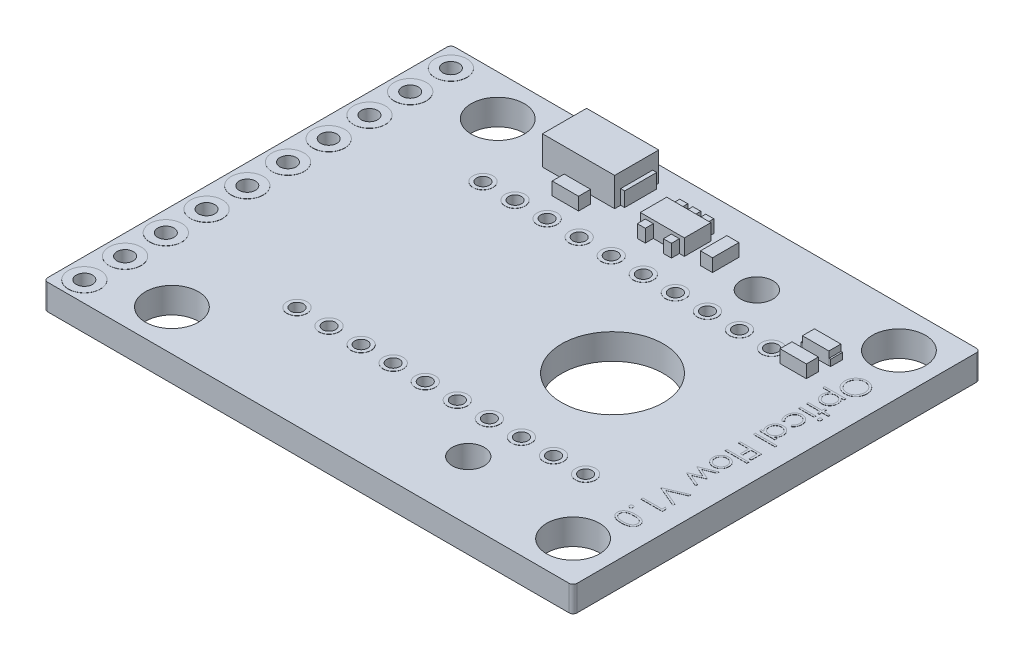
from build123d import *

# Parameters (mm, degrees)
SKETCH1_W             = 33.02
SKETCH1_H             = 25.4
SKETCH1_R             = 1.651
BOSS_EXTRUDE1_DEPTH   = 1.6
SKETCH2_R             = 3.175
SKETCH2_R_2           = 0.4
SKETCH2_R_3           = 1
CUT_EXTRUDE1_DEPTH    = 42.689811705
SKETCH3_R             = 0.508
CUT_EXTRUDE2_DEPTH    = 42.689811705
SKETCH4_W             = 4.5
SKETCH4_H             = 2.75
BOSS_EXTRUDE2_DEPTH   = 1.8
SKETCH5_W             = 0.25
SKETCH5_H             = 2
BOSS_EXTRUDE3_DEPTH   = 0.9
SKETCH6_W             = 2.75
SKETCH6_H             = 1.65
BOSS_EXTRUDE4_DEPTH   = 1
SKETCH7_W             = 0.5
SKETCH7_H             = 0.5
SKETCH7_W_2           = 0.75
SKETCH7_H_2           = 1.64678031
SKETCH7_W_3           = 1.64678031
SKETCH7_H_3           = 0.75
BOSS_EXTRUDE5_DEPTH   = 0.8
BOSS_EXTRUDE6_START   = 0.01
SKETCH9_R             = 1
SKETCH9_R_2           = 0.508
SKETCH9_R_3           = 0.625
SKETCH9_R_4           = 0.4
BOSS_EXTRUDE6_DEPTH   = 0.01
FILLET1_R             = 0.25
SKETCH10_W            = 0.966746795
SKETCH10_H            = 0.118723291
SKETCH10_W_2          = 1.356837607
BOSS_EXTRUDE7_DEPTH   = 0.01
SKETCH11_W            = 0.1
SKETCH11_H            = 0.75
BOSS_EXTRUDE8_DEPTH   = 0.4
SKETCH11_H_2          = 0.740520376
BOSS_EXTRUDE8_2_DEPTH = 0.4


with BuildPart() as part:
    # Sketch1 → Boss-Extrude1 (new body)
    with BuildSketch(Plane(origin=(0, 0, 0), x_dir=(1, 0, 0), z_dir=(0, 1, 0))):
        with Locations((16.51, 12.7)):
            Rectangle(SKETCH1_W, SKETCH1_H)
        with Locations(Location((5.461, 2.54, 0), (0, 0, 270))):
            Circle(SKETCH1_R, mode=Mode.SUBTRACT)
        with Locations(Location((30.48, 2.54, 0), (0, 0, 270))):
            Circle(SKETCH1_R, mode=Mode.SUBTRACT)
        with Locations(Location((30.48, 22.86, 0), (0, 0, 90))):
            Circle(SKETCH1_R, mode=Mode.SUBTRACT)
        with Locations(Location((5.461, 22.86, 0), (0, 0, 90))):
            Circle(SKETCH1_R, mode=Mode.SUBTRACT)
    extrude(amount=BOSS_EXTRUDE1_DEPTH)

    # Sketch2 → Cut-Extrude1 (cut, through all)
    with BuildSketch(Plane(origin=(0, 1.6, 0), x_dir=(1, 0, 0), z_dir=(0, 1, 0))):
        with Locations(Location((22.78, 12.7, 0), (0, 0, 270))):
            Circle(SKETCH2_R)
        with Locations(Location((27.4, 6.4, 0), (0, 0, 270))):
            Circle(SKETCH2_R_2)
        with Locations(Location((25.4, 6.4, 0), (0, 0, 270))):
            Circle(SKETCH2_R_2)
        with Locations(Location((23.4, 6.4, 0), (0, 0, 270))):
            Circle(SKETCH2_R_2)
        with Locations(Location((21.4, 6.4, 0), (0, 0, 270))):
            Circle(SKETCH2_R_2)
        with Locations(Location((19.4, 6.4, 0), (0, 0, 270))):
            Circle(SKETCH2_R_2)
        with Locations(Location((17.4, 6.4, 0), (0, 0, 270))):
            Circle(SKETCH2_R_2)
        with Locations(Location((15.4, 6.4, 0), (0, 0, 270))):
            Circle(SKETCH2_R_2)
        with Locations(Location((13.4, 6.4, 0), (0, 0, 270))):
            Circle(SKETCH2_R_2)
        with Locations(Location((11.4, 6.4, 0), (0, 0, 270))):
            Circle(SKETCH2_R_2)
        with Locations(Location((9.4, 6.4, 0), (0, 0, 270))):
            Circle(SKETCH2_R_2)
        with Locations(Location((26.4, 19, 0), (0, 0, 270))):
            Circle(SKETCH2_R_2)
        with Locations(Location((24.4, 19, 0), (0, 0, 270))):
            Circle(SKETCH2_R_2)
        with Locations(Location((22.4, 19, 0), (0, 0, 270))):
            Circle(SKETCH2_R_2)
        with Locations(Location((20.4, 19, 0), (0, 0, 270))):
            Circle(SKETCH2_R_2)
        with Locations(Location((18.4, 19, 0), (0, 0, 270))):
            Circle(SKETCH2_R_2)
        with Locations(Location((16.4, 19, 0), (0, 0, 270))):
            Circle(SKETCH2_R_2)
        with Locations(Location((14.4, 19, 0), (0, 0, 270))):
            Circle(SKETCH2_R_2)
        with Locations(Location((12.4, 19, 0), (0, 0, 270))):
            Circle(SKETCH2_R_2)
        with Locations(Location((10.4, 19, 0), (0, 0, 270))):
            Circle(SKETCH2_R_2)
        with Locations(Location((8.4, 19, 0), (0, 0, 270))):
            Circle(SKETCH2_R_2)
        with Locations(Location((22.78, 3.7, 0), (0, 0, 270))):
            Circle(SKETCH2_R_3)
        with Locations(Location((22.78, 21.7, 0), (0, 0, 270))):
            Circle(SKETCH2_R_3)
    extrude(amount=-CUT_EXTRUDE1_DEPTH, mode=Mode.SUBTRACT)

    # Sketch3 → Cut-Extrude2 (cut, through all)
    with BuildSketch(Plane(origin=(0, 1.6, 0), x_dir=(1, 0, 0), z_dir=(0, 1, 0))):
        with Locations(Location((1.27, 1.27, 0), (0, 0, 270))):
            Circle(SKETCH3_R)
        with Locations(Location((1.27, 3.81, 0), (0, 0, 270))):
            Circle(SKETCH3_R)
        with Locations(Location((1.27, 6.35, 0), (0, 0, 270))):
            Circle(SKETCH3_R)
        with Locations(Location((1.27, 8.89, 0), (0, 0, 270))):
            Circle(SKETCH3_R)
        with Locations(Location((1.27, 11.43, 0), (0, 0, 270))):
            Circle(SKETCH3_R)
        with Locations(Location((1.27, 13.97, 0), (0, 0, 270))):
            Circle(SKETCH3_R)
        with Locations(Location((1.27, 16.51, 0), (0, 0, 270))):
            Circle(SKETCH3_R)
        with Locations(Location((1.27, 19.05, 0), (0, 0, 270))):
            Circle(SKETCH3_R)
        with Locations(Location((1.27, 21.59, 0), (0, 0, 270))):
            Circle(SKETCH3_R)
        with Locations(Location((1.27, 24.13, 0), (0, 0, 270))):
            Circle(SKETCH3_R)
    extrude(amount=-CUT_EXTRUDE2_DEPTH, mode=Mode.SUBTRACT)

    # Sketch4 → Boss-Extrude2 (add)
    with BuildSketch(Plane(origin=(0, 1.6, 0), x_dir=(1, 0, 0), z_dir=(0, 1, 0))):
        with Locations((11.711, 23.025)):
            Rectangle(SKETCH4_W, SKETCH4_H)
    extrude(amount=BOSS_EXTRUDE2_DEPTH)

    # Sketch5 → Boss-Extrude3 (add)
    with BuildSketch(Plane(origin=(0, 1.6, 0), x_dir=(1, 0, 0), z_dir=(0, 1, 0))):
        with Locations((14.086, 23.025)):
            Rectangle(SKETCH5_W, SKETCH5_H)
        with Locations((9.336, 23.025)):
            Rectangle(SKETCH5_W, SKETCH5_H)
    extrude(amount=BOSS_EXTRUDE3_DEPTH)

    # Sketch6 → Boss-Extrude4 (add)
    with BuildSketch(Plane(origin=(0, 1.6, 0), x_dir=(1, 0, 0), z_dir=(0, 1, 0))):
        with Locations((17.336, 22.075)):
            Rectangle(SKETCH6_W, SKETCH6_H)
    extrude(amount=BOSS_EXTRUDE4_DEPTH)

    # Sketch7 → Boss-Extrude5 (add)
    with BuildSketch(Plane(origin=(0, 1.6, 0), x_dir=(1, 0, 0), z_dir=(0, 1, 0))):
        with Locations((16.5235, 23.15)):
            Rectangle(SKETCH7_W, SKETCH7_H)
        with Locations((17.3335, 23.15)):
            Rectangle(SKETCH7_W, SKETCH7_H)
        with Locations((18.1435, 23.15)):
            Rectangle(SKETCH7_W, SKETCH7_H)
        with Locations((16.5235, 21)):
            Rectangle(SKETCH7_W, SKETCH7_H)
        Polygon((17.898497417, 21.251704542), (17.900012565, 20.751706837), (18.40001027, 20.753221985), (18.398495122, 21.25321969), align=None)
        with Locations((20.086, 22.076609845)):
            Rectangle(SKETCH7_W_2, SKETCH7_H_2)
        with Locations((12.137609845, 20.775)):
            Rectangle(SKETCH7_W_3, SKETCH7_H_3)
        with Locations((28.299452863, 20.222173638)):
            Rectangle(SKETCH7_W_3, SKETCH7_H_3)
        with Locations((28.299452863, 18.822173638)):
            Rectangle(SKETCH7_W_3, SKETCH7_H_3)
    extrude(amount=BOSS_EXTRUDE5_DEPTH)

    # Sketch9 → Boss-Extrude6 (add)
    # profile 1 of 30: a face of its own
    with BuildSketch(Plane(origin=(0, 1.6, 0), x_dir=(1, 0, 0), z_dir=(0, 1, 0)).offset(BOSS_EXTRUDE6_START)):
        with Locations(Location((1.27, 24.13, 0), (0, 0, 90))):
            Circle(SKETCH9_R)
        with Locations(Location((1.27, 24.13, 0), (0, 0, 270))):
            Circle(SKETCH9_R_2, mode=Mode.SUBTRACT)
    # profile 2 of 30: a face of its own
    with BuildSketch(Plane(origin=(0, 1.6, 0), x_dir=(1, 0, 0), z_dir=(0, 1, 0)).offset(BOSS_EXTRUDE6_START)):
        with Locations(Location((1.27, 21.59, 0), (0, 0, 90))):
            Circle(SKETCH9_R)
        with Locations(Location((1.27, 21.59, 0), (0, 0, 270))):
            Circle(SKETCH9_R_2, mode=Mode.SUBTRACT)
    # profile 3 of 30: a face of its own
    with BuildSketch(Plane(origin=(0, 1.6, 0), x_dir=(1, 0, 0), z_dir=(0, 1, 0)).offset(BOSS_EXTRUDE6_START)):
        with Locations(Location((1.27, 19.05, 0), (0, 0, 90))):
            Circle(SKETCH9_R)
        with Locations(Location((1.27, 19.05, 0), (0, 0, 270))):
            Circle(SKETCH9_R_2, mode=Mode.SUBTRACT)
    # profile 4 of 30: a face of its own
    with BuildSketch(Plane(origin=(0, 1.6, 0), x_dir=(1, 0, 0), z_dir=(0, 1, 0)).offset(BOSS_EXTRUDE6_START)):
        with Locations(Location((1.27, 16.51, 0), (0, 0, 90))):
            Circle(SKETCH9_R)
        with Locations(Location((1.27, 16.51, 0), (0, 0, 270))):
            Circle(SKETCH9_R_2, mode=Mode.SUBTRACT)
    # profile 5 of 30: a face of its own
    with BuildSketch(Plane(origin=(0, 1.6, 0), x_dir=(1, 0, 0), z_dir=(0, 1, 0)).offset(BOSS_EXTRUDE6_START)):
        with Locations(Location((1.27, 13.97, 0), (0, 0, 90))):
            Circle(SKETCH9_R)
        with Locations(Location((1.27, 13.97, 0), (0, 0, 270))):
            Circle(SKETCH9_R_2, mode=Mode.SUBTRACT)
    # profile 6 of 30: a face of its own
    with BuildSketch(Plane(origin=(0, 1.6, 0), x_dir=(1, 0, 0), z_dir=(0, 1, 0)).offset(BOSS_EXTRUDE6_START)):
        with Locations(Location((1.27, 11.43, 0), (0, 0, 90))):
            Circle(SKETCH9_R)
        with Locations(Location((1.27, 11.43, 0), (0, 0, 270))):
            Circle(SKETCH9_R_2, mode=Mode.SUBTRACT)
    # profile 7 of 30: a face of its own
    with BuildSketch(Plane(origin=(0, 1.6, 0), x_dir=(1, 0, 0), z_dir=(0, 1, 0)).offset(BOSS_EXTRUDE6_START)):
        with Locations(Location((1.27, 8.89, 0), (0, 0, 90))):
            Circle(SKETCH9_R)
        with Locations(Location((1.27, 8.89, 0), (0, 0, 270))):
            Circle(SKETCH9_R_2, mode=Mode.SUBTRACT)
    # profile 8 of 30: a face of its own
    with BuildSketch(Plane(origin=(0, 1.6, 0), x_dir=(1, 0, 0), z_dir=(0, 1, 0)).offset(BOSS_EXTRUDE6_START)):
        with Locations(Location((1.27, 6.35, 0), (0, 0, 90))):
            Circle(SKETCH9_R)
        with Locations(Location((1.27, 6.35, 0), (0, 0, 270))):
            Circle(SKETCH9_R_2, mode=Mode.SUBTRACT)
    # profile 9 of 30: a face of its own
    with BuildSketch(Plane(origin=(0, 1.6, 0), x_dir=(1, 0, 0), z_dir=(0, 1, 0)).offset(BOSS_EXTRUDE6_START)):
        with Locations(Location((1.27, 3.81, 0), (0, 0, 90))):
            Circle(SKETCH9_R)
        with Locations(Location((1.27, 3.81, 0), (0, 0, 270))):
            Circle(SKETCH9_R_2, mode=Mode.SUBTRACT)
    # profile 10 of 30: a face of its own
    with BuildSketch(Plane(origin=(0, 1.6, 0), x_dir=(1, 0, 0), z_dir=(0, 1, 0)).offset(BOSS_EXTRUDE6_START)):
        with Locations(Location((1.27, 1.27, 0), (0, 0, 90))):
            Circle(SKETCH9_R)
        with Locations(Location((1.27, 1.27, 0), (0, 0, 270))):
            Circle(SKETCH9_R_2, mode=Mode.SUBTRACT)
    # profile 11 of 30: a face of its own
    with BuildSketch(Plane(origin=(0, 1.6, 0), x_dir=(1, 0, 0), z_dir=(0, 1, 0)).offset(BOSS_EXTRUDE6_START)):
        with Locations(Location((8.4, 19, 0), (0, 0, 90))):
            Circle(SKETCH9_R_3)
        with Locations(Location((8.4, 19, 0), (0, 0, 270))):
            Circle(SKETCH9_R_4, mode=Mode.SUBTRACT)
    # profile 12 of 30: a face of its own
    with BuildSketch(Plane(origin=(0, 1.6, 0), x_dir=(1, 0, 0), z_dir=(0, 1, 0)).offset(BOSS_EXTRUDE6_START)):
        with Locations(Location((10.4, 19, 0), (0, 0, 90))):
            Circle(SKETCH9_R_3)
        with Locations(Location((10.4, 19, 0), (0, 0, 270))):
            Circle(SKETCH9_R_4, mode=Mode.SUBTRACT)
    # profile 13 of 30: a face of its own
    with BuildSketch(Plane(origin=(0, 1.6, 0), x_dir=(1, 0, 0), z_dir=(0, 1, 0)).offset(BOSS_EXTRUDE6_START)):
        with Locations(Location((12.4, 19, 0), (0, 0, 90))):
            Circle(SKETCH9_R_3)
        with Locations(Location((12.4, 19, 0), (0, 0, 270))):
            Circle(SKETCH9_R_4, mode=Mode.SUBTRACT)
    # profile 14 of 30: a face of its own
    with BuildSketch(Plane(origin=(0, 1.6, 0), x_dir=(1, 0, 0), z_dir=(0, 1, 0)).offset(BOSS_EXTRUDE6_START)):
        with Locations(Location((14.4, 19, 0), (0, 0, 90))):
            Circle(SKETCH9_R_3)
        with Locations(Location((14.4, 19, 0), (0, 0, 270))):
            Circle(SKETCH9_R_4, mode=Mode.SUBTRACT)
    # profile 15 of 30: a face of its own
    with BuildSketch(Plane(origin=(0, 1.6, 0), x_dir=(1, 0, 0), z_dir=(0, 1, 0)).offset(BOSS_EXTRUDE6_START)):
        with Locations(Location((16.4, 19, 0), (0, 0, 90))):
            Circle(SKETCH9_R_3)
        with Locations(Location((16.4, 19, 0), (0, 0, 270))):
            Circle(SKETCH9_R_4, mode=Mode.SUBTRACT)
    # profile 16 of 30: a face of its own
    with BuildSketch(Plane(origin=(0, 1.6, 0), x_dir=(1, 0, 0), z_dir=(0, 1, 0)).offset(BOSS_EXTRUDE6_START)):
        with Locations(Location((18.4, 19, 0), (0, 0, 90))):
            Circle(SKETCH9_R_3)
        with Locations(Location((18.4, 19, 0), (0, 0, 270))):
            Circle(SKETCH9_R_4, mode=Mode.SUBTRACT)
    # profile 17 of 30: a face of its own
    with BuildSketch(Plane(origin=(0, 1.6, 0), x_dir=(1, 0, 0), z_dir=(0, 1, 0)).offset(BOSS_EXTRUDE6_START)):
        with Locations(Location((20.4, 19, 0), (0, 0, 90))):
            Circle(SKETCH9_R_3)
        with Locations(Location((20.4, 19, 0), (0, 0, 270))):
            Circle(SKETCH9_R_4, mode=Mode.SUBTRACT)
    # profile 18 of 30: a face of its own
    with BuildSketch(Plane(origin=(0, 1.6, 0), x_dir=(1, 0, 0), z_dir=(0, 1, 0)).offset(BOSS_EXTRUDE6_START)):
        with Locations(Location((22.4, 19, 0), (0, 0, 90))):
            Circle(SKETCH9_R_3)
        with Locations(Location((22.4, 19, 0), (0, 0, 270))):
            Circle(SKETCH9_R_4, mode=Mode.SUBTRACT)
    # profile 19 of 30: a face of its own
    with BuildSketch(Plane(origin=(0, 1.6, 0), x_dir=(1, 0, 0), z_dir=(0, 1, 0)).offset(BOSS_EXTRUDE6_START)):
        with Locations(Location((24.4, 19, 0), (0, 0, 90))):
            Circle(SKETCH9_R_3)
        with Locations(Location((24.4, 19, 0), (0, 0, 270))):
            Circle(SKETCH9_R_4, mode=Mode.SUBTRACT)
    # profile 20 of 30: a face of its own
    with BuildSketch(Plane(origin=(0, 1.6, 0), x_dir=(1, 0, 0), z_dir=(0, 1, 0)).offset(BOSS_EXTRUDE6_START)):
        with Locations(Location((26.4, 19, 0), (0, 0, 90))):
            Circle(SKETCH9_R_3)
        with Locations(Location((26.4, 19, 0), (0, 0, 270))):
            Circle(SKETCH9_R_4, mode=Mode.SUBTRACT)
    # profile 21 of 30: a face of its own
    with BuildSketch(Plane(origin=(0, 1.6, 0), x_dir=(1, 0, 0), z_dir=(0, 1, 0)).offset(BOSS_EXTRUDE6_START)):
        with Locations(Location((9.4, 6.4, 0), (0, 0, 90))):
            Circle(SKETCH9_R_3)
        with Locations(Location((9.4, 6.4, 0), (0, 0, 270))):
            Circle(SKETCH9_R_4, mode=Mode.SUBTRACT)
    # profile 22 of 30: a face of its own
    with BuildSketch(Plane(origin=(0, 1.6, 0), x_dir=(1, 0, 0), z_dir=(0, 1, 0)).offset(BOSS_EXTRUDE6_START)):
        with Locations(Location((11.4, 6.4, 0), (0, 0, 90))):
            Circle(SKETCH9_R_3)
        with Locations(Location((11.4, 6.4, 0), (0, 0, 270))):
            Circle(SKETCH9_R_4, mode=Mode.SUBTRACT)
    # profile 23 of 30: a face of its own
    with BuildSketch(Plane(origin=(0, 1.6, 0), x_dir=(1, 0, 0), z_dir=(0, 1, 0)).offset(BOSS_EXTRUDE6_START)):
        with Locations(Location((13.4, 6.4, 0), (0, 0, 90))):
            Circle(SKETCH9_R_3)
        with Locations(Location((13.4, 6.4, 0), (0, 0, 270))):
            Circle(SKETCH9_R_4, mode=Mode.SUBTRACT)
    # profile 24 of 30: a face of its own
    with BuildSketch(Plane(origin=(0, 1.6, 0), x_dir=(1, 0, 0), z_dir=(0, 1, 0)).offset(BOSS_EXTRUDE6_START)):
        with Locations(Location((15.4, 6.4, 0), (0, 0, 90))):
            Circle(SKETCH9_R_3)
        with Locations(Location((15.4, 6.4, 0), (0, 0, 270))):
            Circle(SKETCH9_R_4, mode=Mode.SUBTRACT)
    # profile 25 of 30: a face of its own
    with BuildSketch(Plane(origin=(0, 1.6, 0), x_dir=(1, 0, 0), z_dir=(0, 1, 0)).offset(BOSS_EXTRUDE6_START)):
        with Locations(Location((17.4, 6.4, 0), (0, 0, 90))):
            Circle(SKETCH9_R_3)
        with Locations(Location((17.4, 6.4, 0), (0, 0, 270))):
            Circle(SKETCH9_R_4, mode=Mode.SUBTRACT)
    # profile 26 of 30: a face of its own
    with BuildSketch(Plane(origin=(0, 1.6, 0), x_dir=(1, 0, 0), z_dir=(0, 1, 0)).offset(BOSS_EXTRUDE6_START)):
        with Locations(Location((19.4, 6.4, 0), (0, 0, 90))):
            Circle(SKETCH9_R_3)
        with Locations(Location((19.4, 6.4, 0), (0, 0, 270))):
            Circle(SKETCH9_R_4, mode=Mode.SUBTRACT)
    # profile 27 of 30: a face of its own
    with BuildSketch(Plane(origin=(0, 1.6, 0), x_dir=(1, 0, 0), z_dir=(0, 1, 0)).offset(BOSS_EXTRUDE6_START)):
        with Locations(Location((21.4, 6.4, 0), (0, 0, 90))):
            Circle(SKETCH9_R_3)
        with Locations(Location((21.4, 6.4, 0), (0, 0, 270))):
            Circle(SKETCH9_R_4, mode=Mode.SUBTRACT)
    # profile 28 of 30: a face of its own
    with BuildSketch(Plane(origin=(0, 1.6, 0), x_dir=(1, 0, 0), z_dir=(0, 1, 0)).offset(BOSS_EXTRUDE6_START)):
        with Locations(Location((23.4, 6.4, 0), (0, 0, 90))):
            Circle(SKETCH9_R_3)
        with Locations(Location((23.4, 6.4, 0), (0, 0, 270))):
            Circle(SKETCH9_R_4, mode=Mode.SUBTRACT)
    # profile 29 of 30: a face of its own
    with BuildSketch(Plane(origin=(0, 1.6, 0), x_dir=(1, 0, 0), z_dir=(0, 1, 0)).offset(BOSS_EXTRUDE6_START)):
        with Locations(Location((25.4, 6.4, 0), (0, 0, 90))):
            Circle(SKETCH9_R_3)
        with Locations(Location((25.4, 6.4, 0), (0, 0, 270))):
            Circle(SKETCH9_R_4, mode=Mode.SUBTRACT)
    # profile 30 of 30: a face of its own
    with BuildSketch(Plane(origin=(0, 1.6, 0), x_dir=(1, 0, 0), z_dir=(0, 1, 0)).offset(BOSS_EXTRUDE6_START)):
        with Locations(Location((27.4, 6.4, 0), (0, 0, 90))):
            Circle(SKETCH9_R_3)
        with Locations(Location((27.4, 6.4, 0), (0, 0, 270))):
            Circle(SKETCH9_R_4, mode=Mode.SUBTRACT)
    boss_extrude6 = extrude(amount=-BOSS_EXTRUDE6_DEPTH)

    # Mirror1: Boss-Extrude6 across plane
    add(boss_extrude6.mirror(Plane.ZX.offset(0.8)))

    # Fillet1
    fillet1_edges = [part.edges().sort_by_distance(p)[0] for p in [
        (0, 0.8, -25.4),
        (33.02, 0.8, -25.4),
        (33.02, 0.8, 0),
        (0, 0.8, 0),
    ]]
    fillet(fillet1_edges, radius=FILLET1_R)

    # Sketch10 → Boss-Extrude7 (add)
    # profile 1 of 16: a face of its own
    with BuildSketch(Plane(origin=(0, 1.6, 0), x_dir=(1, 0, 0), z_dir=(0, 1, 0))):
        with BuildLine():
            add(Edge.make_bspline(
                [(31.836837607, 19.527267628), (31.836217161, 19.502771712), (31.834998554, 19.454659712), (31.825670521, 19.383949785), (31.809532386, 19.316445348), (31.788040606, 19.251594984), (31.759365489, 19.190179965), (31.724725552, 19.131717187), (31.683628135, 19.076371947), (31.636762834, 19.024651551), (31.585585601, 18.977496232), (31.530812825, 18.936296954), (31.473194534, 18.901463276), (31.41253023, 18.872912553), (31.34908692, 18.850493987), (31.282503875, 18.835028954), (31.213218591, 18.825148975), (31.165961374, 18.823994017), (31.141988348, 18.82340812)],
                knots=[0, 0, 0, 0, 1.06508495, 2.091914715, 3.094501328, 4.079693967, 5.057647778, 6.035986298, 7.030177474, 8.050107388, 9.066943579, 10.051896531, 11.025616101, 11.9896488, 12.96281505, 13.945825876, 14.957941789, 16, 16, 16, 16], degree=3))
            add(Edge.make_bspline(
                [(31.141988348, 18.82340812), (31.118191912, 18.82399393), (31.071286379, 18.825148629), (31.002440788, 18.835040199), (30.936259593, 18.85055127), (30.872859702, 18.872704592), (30.812150395, 18.901118158), (30.754426195, 18.936187261), (30.699274167, 18.977113772), (30.647848492, 19.024106103), (30.600600537, 19.075271132), (30.559337205, 19.130198363), (30.524074642, 19.187759949), (30.495719746, 19.24838758), (30.473142518, 19.311405358), (30.457734881, 19.377390837), (30.447800125, 19.446049586), (30.446659044, 19.492869783), (30.44607906, 19.516667334)],
                knots=[0, 0, 0, 0, 1.04355943, 2.056976533, 3.044937463, 4.02179873, 4.997890911, 5.980248884, 6.980147982, 8.006253959, 9.032111064, 10.031228745, 11.015595249, 11.988180414, 12.962670953, 13.946861971, 14.95644057, 16, 16, 16, 16], degree=3))
            add(Edge.make_bspline(
                [(30.44607906, 19.516667334), (30.446664613, 19.540640264), (30.447818893, 19.587897289), (30.457715967, 19.657269246), (30.473186673, 19.723900501), (30.495316964, 19.787585897), (30.523810096, 19.848346333), (30.558823923, 19.906175932), (30.60008291, 19.961144185), (30.647012677, 20.012691728), (30.698202294, 20.059799214), (30.752768486, 20.101232968), (30.810192297, 20.136044933), (30.870237014, 20.164550093), (30.932747433, 20.187096589), (30.998116767, 20.202483466), (31.065978716, 20.212437443), (31.112183581, 20.213584595), (31.135628172, 20.214166667)],
                knots=[0, 0, 0, 0, 1.053167129, 2.076072758, 3.073341244, 4.055601477, 5.033424535, 6.017524495, 7.021518915, 8.049444456, 9.077120685, 10.074910483, 11.055688766, 12.022980584, 12.991883888, 13.970269434, 14.970104079, 16, 16, 16, 16], degree=3))
            add(Edge.make_bspline(
                [(31.135628172, 20.214166667), (31.151364401, 20.213964772), (31.182638341, 20.213563531), (31.229077932, 20.208725849), (31.274775689, 20.201720187), (31.319577996, 20.191627455), (31.363492171, 20.178608687), (31.406428407, 20.162565265), (31.448740371, 20.144179496), (31.489622792, 20.122288699), (31.529139839, 20.098405185), (31.566797383, 20.072362612), (31.601922758, 20.043979399), (31.635080374, 20.013660995), (31.665704305, 19.980987724), (31.694462224, 19.946451319), (31.721056438, 19.909871068), (31.744928397, 19.87118912), (31.766855081, 19.831391686), (31.785162058, 19.790190032), (31.80134297, 19.748453473), (31.814201997, 19.705814377), (31.824435288, 19.662371375), (31.83138855, 19.618070158), (31.836236981, 19.572956356), (31.836636537, 19.542562729), (31.836837607, 19.527267628)],
                knots=[0, 0, 0, 0, 1.037115869, 2.061148057, 3.07517727, 4.084041727, 5.086514338, 6.092668487, 7.104487461, 8.125783165, 9.147610153, 10.147694368, 11.141876323, 12.122903372, 13.107606018, 14.091946891, 15.084523921, 16.086505767, 17.087268121, 18.077809654, 19.05670789, 20.036870126, 21.011670792, 21.99694167, 22.991993299, 24, 24, 24, 24], degree=3))
        make_face()
        with BuildLine():
            add(Edge.make_bspline(
                [(31.701153846, 19.521437467), (31.70100088, 19.533991836), (31.70069641, 19.558980554), (31.696682846, 19.596129345), (31.690968164, 19.632791582), (31.68279573, 19.66896527), (31.671763242, 19.704455744), (31.658763808, 19.739617426), (31.643471943, 19.774281481), (31.625641249, 19.808060389), (31.606163152, 19.84089769), (31.584785265, 19.872095857), (31.561611248, 19.901343669), (31.536947216, 19.928734816), (31.51054222, 19.954189482), (31.482817688, 19.978223649), (31.452975499, 19.999870008), (31.421826396, 20.019708355), (31.389410541, 20.037461067), (31.356069319, 20.05324738), (31.321530727, 20.066160561), (31.286169484, 20.076691876), (31.25004159, 20.085423055), (31.21287298, 20.09095433), (31.174850423, 20.095010906), (31.149154901, 20.095298109), (31.136158186, 20.095443376)],
                knots=[0, 0, 0, 0, 1.008585988, 2.007529826, 2.999688727, 3.990042337, 4.984966365, 5.984641633, 7.001812546, 8.027570247, 9.052811818, 10.068991095, 11.064725446, 12.050001529, 13.029093193, 14.010961114, 14.996492974, 15.989185205, 16.977398719, 17.96520407, 18.951579521, 19.937648295, 20.929603947, 21.935788061, 22.955928099, 24, 24, 24, 24], degree=3))
            add(Edge.make_bspline(
                [(31.136158186, 20.095443376), (31.117046871, 20.094961509), (31.079449001, 20.094013526), (31.024352113, 20.085714088), (30.971402076, 20.072930186), (30.920888616, 20.054085289), (30.872377533, 20.030518241), (30.826299172, 20.001403911), (30.78264108, 19.966910149), (30.741708047, 19.927727804), (30.704346686, 19.884894519), (30.671552184, 19.839411613), (30.643804857, 19.79176635), (30.621199964, 19.741834485), (30.603287771, 19.689882588), (30.591011622, 19.635575894), (30.582932209, 19.579276167), (30.582156316, 19.540899997), (30.581762821, 19.521437467)],
                knots=[0, 0, 0, 0, 1.032063989, 2.030389145, 3.003944642, 3.970395727, 4.937377036, 5.913328081, 6.909231446, 7.93887556, 8.970685674, 9.976071282, 10.964166581, 11.944589148, 12.933237628, 13.927779006, 14.949070134, 16, 16, 16, 16], degree=3))
            add(Edge.make_bspline(
                [(30.581762821, 19.521437467), (30.581942549, 19.508355899), (30.582299005, 19.48241122), (30.585889287, 19.443821549), (30.591646542, 19.405927068), (30.599935915, 19.36878105), (30.610309907, 19.332425201), (30.622636335, 19.296709459), (30.638007278, 19.26200796), (30.655017596, 19.22790672), (30.674269988, 19.195259112), (30.695349055, 19.164284465), (30.71810863, 19.135162351), (30.742558483, 19.107829694), (30.768487852, 19.082198657), (30.796563421, 19.058965228), (30.825965257, 19.037059548), (30.857187015, 19.017300637), (30.889671179, 18.99958322), (30.923138694, 18.984176827), (30.957474544, 18.97109842), (30.992736924, 18.960542622), (31.028856545, 18.9522703), (31.065882395, 18.946570487), (31.103740234, 18.942583418), (31.1293458, 18.942282899), (31.142253355, 18.94213141)],
                knots=[0, 0, 0, 0, 1.047226202, 2.076964084, 3.100341814, 4.114585567, 5.122123135, 6.126552355, 7.137064942, 8.158803602, 9.176592812, 10.169297945, 11.156925011, 12.133779169, 13.104132798, 14.073170763, 15.049307625, 16.038276215, 17.028988595, 18.010110019, 18.986169996, 19.968539974, 20.955178716, 21.950601663, 22.966915103, 24, 24, 24, 24], degree=3))
            add(Edge.make_bspline(
                [(31.142253355, 18.94213141), (31.155072608, 18.942283021), (31.180501958, 18.94258377), (31.21809578, 18.946568574), (31.254855178, 18.952276351), (31.290635842, 18.960502137), (31.325446891, 18.971104427), (31.359255632, 18.984177615), (31.392188015, 18.999593487), (31.424162646, 19.017285881), (31.454844764, 19.03717341), (31.484176628, 19.058904865), (31.511607397, 19.082855457), (31.537814257, 19.10834089), (31.562238295, 19.135997739), (31.584887528, 19.165700746), (31.606308876, 19.197089222), (31.625632358, 19.230323842), (31.643481071, 19.264622078), (31.658760063, 19.299819949), (31.671819463, 19.33558038), (31.682750572, 19.371720279), (31.69097617, 19.408494238), (31.696680795, 19.445688105), (31.70069684, 19.483365455), (31.701001027, 19.508706524), (31.701153846, 19.521437467)],
                knots=[0, 0, 0, 0, 1.029967493, 2.04313025, 3.035375922, 4.01889446, 4.991458755, 5.958017022, 6.930036849, 7.912118993, 8.892942568, 9.867138445, 10.843712051, 11.817804417, 12.803729339, 13.806387533, 14.818654169, 15.856205545, 16.894655496, 17.924916651, 18.938004761, 19.953404357, 20.957695443, 21.963967554, 22.97713031, 24, 24, 24, 24], degree=3))
        make_face(mode=Mode.SUBTRACT)
    # profile 2 of 16: a face of its own
    with BuildSketch(Plane(origin=(0, 1.6, 0), x_dir=(1, 0, 0), z_dir=(0, 1, 0))):
        with BuildLine():
            Line((31.446746795, 18.585961538), (31.446746795, 18.467238248))
            Line((31.446746795, 18.467238248), (31.267866837, 18.467238248))
            add(Edge.make_bspline(
                [(31.267866837, 18.467238248), (31.284092232, 18.454626769), (31.31562304, 18.430118884), (31.356545578, 18.387882159), (31.390803481, 18.343089341), (31.4177992, 18.2950641), (31.438256719, 18.24438503), (31.453227197, 18.191103479), (31.462099298, 18.134774709), (31.463164184, 18.096259675), (31.463707265, 18.076617421)],
                knots=[0, 0, 0, 0, 1.082960489, 2.104516986, 3.092433479, 4.050182639, 5.001196938, 5.969027827, 6.964226023, 8, 8, 8, 8], degree=3))
            add(Edge.make_bspline(
                [(31.463707265, 18.076617421), (31.463210915, 18.059460476), (31.462229852, 18.025548872), (31.455587656, 17.975632116), (31.444203885, 17.927562849), (31.427799373, 17.881613019), (31.407518882, 17.837290373), (31.381923455, 17.795251067), (31.352287782, 17.754840289), (31.318182177, 17.717074348), (31.281281017, 17.682179069), (31.241585087, 17.651999114), (31.200399823, 17.625967174), (31.157086741, 17.604925127), (31.111986913, 17.58844221), (31.064918127, 17.576719401), (31.0160549, 17.569742851), (30.982829764, 17.568806811), (30.966023471, 17.568333333)],
                knots=[0, 0, 0, 0, 1.041296284, 2.058176809, 3.050446431, 4.034000596, 5.01514041, 6.003636468, 7.015969324, 8.052561599, 9.08815499, 10.094063707, 11.074456064, 12.040834395, 13.011057502, 13.983766392, 14.980127149, 16, 16, 16, 16], degree=3))
            add(Edge.make_bspline(
                [(30.966023471, 17.568333333), (30.948861497, 17.568793963), (30.915015609, 17.569702391), (30.865330713, 17.576824522), (30.817440665, 17.588018402), (30.771801225, 17.604797147), (30.727752067, 17.625340004), (30.686037626, 17.65104354), (30.646260228, 17.681202143), (30.609090863, 17.71572244), (30.574841042, 17.753157467), (30.544906418, 17.79318417), (30.519659006, 17.835205335), (30.498864095, 17.879020092), (30.482836745, 17.924781521), (30.471490692, 17.972464943), (30.464432008, 18.022080695), (30.463507249, 18.055835194), (30.46303953, 18.072907318)],
                knots=[0, 0, 0, 0, 1.038787011, 2.048637893, 3.033314735, 4.011256821, 4.987456671, 5.971770257, 6.972013799, 8.005388554, 9.039095487, 10.040396776, 11.026510796, 12.002710647, 12.972028308, 13.95670515, 14.966556032, 16, 16, 16, 16], degree=3))
            add(Edge.make_bspline(
                [(30.46303953, 18.072907318), (30.463514348, 18.092209921), (30.464447989, 18.130164873), (30.474385657, 18.185704887), (30.488800609, 18.239092643), (30.510533545, 18.289764161), (30.537483427, 18.338332057), (30.571181944, 18.384026068), (30.610020446, 18.427865808), (30.639933393, 18.453951326), (30.655169855, 18.467238248)],
                knots=[0, 0, 0, 0, 1.019281043, 2.00422519, 2.974076634, 3.936751752, 4.91100001, 5.903882226, 6.932321223, 8, 8, 8, 8], degree=3))
            Line((30.655169855, 18.467238248), (30.123830128, 18.467238248))
            Line((30.123830128, 18.467238248), (30.123830128, 18.585961538))
            Line((30.123830128, 18.585961538), (31.446746795, 18.585961538))
        make_face()
        with BuildLine():
            add(Edge.make_bspline(
                [(31.344983974, 18.077677451), (31.344741612, 18.091125499), (31.344264462, 18.11760124), (31.338609817, 18.156411453), (31.330374587, 18.193782193), (31.318030206, 18.229316239), (31.302517583, 18.263302738), (31.283774207, 18.295800657), (31.260957961, 18.326263475), (31.235396769, 18.355052108), (31.207372453, 18.38135271), (31.177189841, 18.40437352), (31.14526455, 18.423743955), (31.111762625, 18.439804649), (31.076443513, 18.452030731), (31.039502492, 18.460707147), (31.000900722, 18.466161559), (30.974610197, 18.466875521), (30.961253339, 18.467238248)],
                knots=[0, 0, 0, 0, 1.056783697, 2.080534709, 3.078213817, 4.062450963, 5.032388505, 6.013014931, 7.006476528, 8.020136409, 9.037574406, 10.02408906, 10.99988041, 11.969394914, 12.94050107, 13.932990591, 14.949859205, 16, 16, 16, 16], degree=3))
            add(Edge.make_bspline(
                [(30.961253339, 18.467238248), (30.943722412, 18.466629104), (30.909377843, 18.465435739), (30.859123066, 18.455964646), (30.811745198, 18.439952378), (30.767269602, 18.417945442), (30.726572772, 18.389935339), (30.689838627, 18.356557157), (30.657893827, 18.317431338), (30.630879858, 18.273581152), (30.60896677, 18.226546981), (30.593274069, 18.177492458), (30.583608718, 18.127083329), (30.582381451, 18.093001902), (30.581762821, 18.075822399)],
                knots=[0, 0, 0, 0, 1.037446521, 2.0324456, 3.014856775, 3.990198243, 4.96070402, 5.930645943, 6.919052903, 7.940784962, 8.972706292, 9.9832942, 10.983434506, 12, 12, 12, 12], degree=3))
            add(Edge.make_bspline(
                [(30.581762821, 18.075822399), (30.582351099, 18.058988946), (30.583518725, 18.025577568), (30.593625053, 17.976380797), (30.609063771, 17.92857073), (30.631574831, 17.883144032), (30.659167208, 17.840504884), (30.692248498, 17.801975954), (30.730700528, 17.768376585), (30.773255549, 17.7393913), (30.819089073, 17.716243142), (30.866583373, 17.699279649), (30.915334943, 17.689168515), (30.94822241, 17.687761509), (30.964698434, 17.687056624)],
                knots=[0, 0, 0, 0, 1.000942316, 1.986690553, 2.977613063, 3.984008645, 4.994597959, 5.993715906, 6.995776077, 8.025307715, 9.050480445, 10.043228463, 11.019692995, 12, 12, 12, 12], degree=3))
            add(Edge.make_bspline(
                [(30.964698434, 17.687056624), (30.98127351, 17.687608449), (31.014294525, 17.688707801), (31.06297974, 17.699468499), (31.110462786, 17.715784609), (31.155887243, 17.738988755), (31.198259172, 17.767453486), (31.235995186, 17.801298495), (31.268924995, 17.839358305), (31.296150142, 17.881944208), (31.317801337, 17.927658945), (31.333632717, 17.975780384), (31.343147698, 18.026067849), (31.344366498, 18.060322924), (31.344983974, 18.077677451)],
                knots=[0, 0, 0, 0, 0.983883291, 1.96010114, 2.949781603, 3.961842304, 4.982704228, 5.97556912, 6.965945748, 7.965066277, 8.970293822, 9.964878779, 10.968953791, 12, 12, 12, 12], degree=3))
        make_face(mode=Mode.SUBTRACT)
    # profile 3 of 16: a face of its own
    with BuildSketch(Plane(origin=(0, 1.6, 0), x_dir=(1, 0, 0), z_dir=(0, 1, 0))):
        Polygon((31.836837607, 17.212163462), (31.836837607, 17.093440171), (31.446746795, 17.093440171), (31.446746795, 16.92383547), (31.328023504, 16.92383547), (31.328023504, 17.093440171), (30.48, 17.093440171), (30.48, 17.212163462), (31.328023504, 17.212163462), (31.328023504, 17.381768162), (31.446746795, 17.381768162), (31.446746795, 17.212163462), align=None)
    # profile 4 of 16: a face of its own
    with BuildSketch(Plane(origin=(0, 1.6, 0), x_dir=(1, 0, 0), z_dir=(0, 1, 0))):
        with BuildLine():
            add(Edge.make_bspline(
                [(31.853798077, 16.661478198), (31.853454846, 16.654112175), (31.852782735, 16.639688087), (31.847073114, 16.618808874), (31.837247331, 16.599816025), (31.824493224, 16.582718427), (31.808877093, 16.568545304), (31.791133716, 16.55838242), (31.771817288, 16.551894466), (31.758358013, 16.551106381), (31.751505242, 16.550705128)],
                knots=[0, 0, 0, 0, 1.054986045, 2.065865298, 3.074122704, 4.105114675, 5.109626121, 6.074217918, 7.019490725, 8, 8, 8, 8], degree=3))
            add(Edge.make_bspline(
                [(31.751505242, 16.550705128), (31.744830347, 16.551115357), (31.73163487, 16.551926331), (31.712653364, 16.558377624), (31.69515706, 16.568630507), (31.67957146, 16.582708993), (31.666824722, 16.599818517), (31.656996992, 16.618808215), (31.651287885, 16.63968826), (31.650615703, 16.654112234), (31.650272436, 16.661478198)],
                knots=[0, 0, 0, 0, 0.961106377, 1.899993565, 2.859409042, 3.870007927, 4.90724781, 5.921615355, 6.938620636, 8, 8, 8, 8], degree=3))
            add(Edge.make_bspline(
                [(31.650272436, 16.661478198), (31.650604678, 16.668759563), (31.651251344, 16.682931789), (31.657065296, 16.703427094), (31.66680335, 16.722114341), (31.679747858, 16.73893233), (31.695053426, 16.753289942), (31.712666581, 16.763504995), (31.731631505, 16.769973537), (31.744829217, 16.770782186), (31.751505242, 16.771191239)],
                knots=[0, 0, 0, 0, 1.055304112, 2.054011575, 3.063363921, 4.096942562, 5.122536081, 6.088009498, 7.032825006, 8, 8, 8, 8], degree=3))
            add(Edge.make_bspline(
                [(31.751505242, 16.771191239), (31.758359186, 16.770791206), (31.771820766, 16.770005516), (31.791120274, 16.763499975), (31.808981611, 16.753376197), (31.824316954, 16.738923053), (31.837268655, 16.72211677), (31.847004828, 16.703426462), (31.852819272, 16.682931956), (31.85346587, 16.66875962), (31.853798077, 16.661478198)],
                knots=[0, 0, 0, 0, 0.986662878, 1.937868148, 2.908513651, 3.927890639, 4.955204348, 5.958438607, 6.951092507, 8, 8, 8, 8], degree=3))
        make_face()
    # profile 5 of 16: a face of its own
    with BuildSketch(Plane(origin=(0, 1.6, 0), x_dir=(1, 0, 0), z_dir=(0, 1, 0))):
        with Locations((30.963373397, 16.660948184)):
            Rectangle(SKETCH10_W, SKETCH10_H)
    # profile 6 of 16: a face of its own
    with BuildSketch(Plane(origin=(0, 1.6, 0), x_dir=(1, 0, 0), z_dir=(0, 1, 0))):
        with BuildLine():
            Line((31.237125985, 15.380432692), (31.175379274, 15.479810447))
            add(Edge.make_bspline(
                [(31.175379274, 15.479810447), (31.188922701, 15.490706841), (31.215580637, 15.512154544), (31.249963846, 15.549408711), (31.279615357, 15.58913057), (31.303456435, 15.63206907), (31.322276512, 15.677848004), (31.335356217, 15.726561683), (31.343577542, 15.778195078), (31.344507482, 15.813599383), (31.344983974, 15.831740201)],
                knots=[0, 0, 0, 0, 1.026629843, 2.020746545, 2.988156479, 3.951609825, 4.916760838, 5.907688704, 6.927920211, 8, 8, 8, 8], degree=3))
            add(Edge.make_bspline(
                [(31.344983974, 15.831740201), (31.344584489, 15.846238956), (31.343797713, 15.874793861), (31.338880402, 15.91671399), (31.329943037, 15.956643401), (31.318173224, 15.994837572), (31.302376067, 16.031005907), (31.283268096, 16.065249733), (31.260767891, 16.097683586), (31.235037547, 16.127792227), (31.206776326, 16.15523172), (31.176931271, 16.17949966), (31.145293421, 16.199754484), (31.112463246, 16.216638499), (31.077875957, 16.229341723), (31.041951737, 16.238683362), (31.004454198, 16.244377468), (30.978940123, 16.24506739), (30.966023471, 16.245416667)],
                knots=[0, 0, 0, 0, 1.11253269, 2.191102883, 3.232049486, 4.248096668, 5.252846381, 6.25411548, 7.252444123, 8.276484619, 9.287796331, 10.271127345, 11.222403915, 12.165070373, 13.097940083, 14.043161362, 15.009338842, 16, 16, 16, 16], degree=3))
            add(Edge.make_bspline(
                [(30.966023471, 16.245416667), (30.949101034, 16.244745671), (30.915484176, 16.24341272), (30.865875145, 16.232919743), (30.817820499, 16.215853897), (30.771962517, 16.192038222), (30.72944394, 16.162408137), (30.690998738, 16.127833546), (30.658227593, 16.087547395), (30.63080068, 16.042732116), (30.608663539, 15.994196891), (30.593042714, 15.942326468), (30.583561343, 15.887562566), (30.582370158, 15.850064118), (30.581762821, 15.830945179)],
                knots=[0, 0, 0, 0, 0.966447457, 1.919872872, 2.884287729, 3.873230387, 4.863319139, 5.838939256, 6.818209587, 7.819967013, 8.834377336, 9.85802846, 10.90789553, 12, 12, 12, 12], degree=3))
            add(Edge.make_bspline(
                [(30.581762821, 15.830945179), (30.582254, 15.813424023), (30.583219297, 15.778990302), (30.591356732, 15.728656239), (30.604677987, 15.680736451), (30.623254628, 15.635232642), (30.647266516, 15.59222796), (30.676884417, 15.552000266), (30.711256287, 15.513749099), (30.737834806, 15.491260658), (30.751367521, 15.479810447)],
                knots=[0, 0, 0, 0, 1.039848629, 2.043578496, 3.018386758, 3.987534228, 4.954977003, 5.934852016, 6.948509513, 8, 8, 8, 8], degree=3))
            Line((30.751367521, 15.479810447), (30.686175714, 15.380432692))
            add(Edge.make_bspline(
                [(30.686175714, 15.380432692), (30.677523635, 15.386324523), (30.660248195, 15.398088629), (30.635888799, 15.417753081), (30.613092612, 15.438967875), (30.591866439, 15.461633308), (30.571837951, 15.485461734), (30.553574746, 15.511073395), (30.53661468, 15.538032279), (30.521245071, 15.566462073), (30.507459842, 15.596082787), (30.495530023, 15.626895325), (30.485443388, 15.658760498), (30.477281666, 15.6916067), (30.470824775, 15.725485767), (30.466530408, 15.760371898), (30.463327752, 15.796258565), (30.463136437, 15.820514075), (30.46303953, 15.83280023)],
                knots=[0, 0, 0, 0, 0.954067324, 1.904967979, 2.850944488, 3.791040077, 4.734579251, 5.686741025, 6.656553487, 7.63677735, 8.631289747, 9.633371755, 10.647134148, 11.676547777, 12.717490898, 13.789379914, 14.88025357, 16, 16, 16, 16], degree=3))
            add(Edge.make_bspline(
                [(30.46303953, 15.83280023), (30.463376412, 15.851551963), (30.464036705, 15.888305495), (30.471297051, 15.942100016), (30.482242342, 15.99350994), (30.497952437, 16.042517726), (30.518175993, 16.08913092), (30.542879259, 16.13330637), (30.572267929, 16.174896634), (30.605816837, 16.213494849), (30.642198313, 16.248931803), (30.681433928, 16.279405253), (30.722214744, 16.305695331), (30.7650157, 16.32737638), (30.809998729, 16.343754458), (30.856811702, 16.355410693), (30.905453523, 16.362831852), (30.938612495, 16.363699887), (30.955423177, 16.364139957)],
                knots=[0, 0, 0, 0, 1.112900083, 2.181292239, 3.217426397, 4.231060065, 5.231907716, 6.230057215, 7.231385915, 8.250448267, 9.26326716, 10.242335464, 11.195469137, 12.140906363, 13.085222324, 14.031808558, 15.002181388, 16, 16, 16, 16], degree=3))
            add(Edge.make_bspline(
                [(30.955423177, 16.364139957), (30.966828082, 16.363963123), (30.98951432, 16.363611369), (31.023231286, 16.359956275), (31.056351075, 16.354481795), (31.088826153, 16.34670983), (31.120754757, 16.336957282), (31.15196637, 16.324700202), (31.182642597, 16.310355936), (31.212405726, 16.293667436), (31.241075526, 16.275258925), (31.268488761, 16.255255092), (31.293943338, 16.233311984), (31.318076317, 16.209893813), (31.340167179, 16.184645789), (31.361170329, 16.158038276), (31.379997614, 16.129414678), (31.397578506, 16.099504508), (31.413205017, 16.068269122), (31.426675248, 16.035928361), (31.438185135, 16.002668714), (31.447297858, 15.968439238), (31.454939529, 15.93346652), (31.459746581, 15.897475129), (31.463143176, 15.86060271), (31.463517672, 15.835635106), (31.463707265, 15.822994959)],
                knots=[0, 0, 0, 0, 0.991083503, 1.971428668, 2.944771278, 3.907728914, 4.872032831, 5.84458753, 6.820199395, 7.813689706, 8.808455339, 9.780676499, 10.761021664, 11.727616056, 12.70141294, 13.675300653, 14.672050164, 15.67696011, 16.690052069, 17.705469636, 18.720567748, 19.746988726, 20.783187267, 21.830086354, 22.901455311, 24, 24, 24, 24], degree=3))
            add(Edge.make_bspline(
                [(31.463707265, 15.822994959), (31.463358905, 15.80716523), (31.462663925, 15.775584898), (31.456811988, 15.728738923), (31.447996551, 15.682579802), (31.434909644, 15.637932234), (31.419183072, 15.595359057), (31.401181981, 15.55558479), (31.380785388, 15.51923307), (31.358111544, 15.485966197), (31.332665737, 15.455652094), (31.304008454, 15.427965845), (31.272313054, 15.402326494), (31.248951807, 15.387790856), (31.237125985, 15.380432692)],
                knots=[0, 0, 0, 0, 1.095247575, 2.185020588, 3.262981163, 4.344680461, 5.40090428, 6.402280576, 7.363136638, 8.282296962, 9.184898179, 10.097200524, 11.036773704, 12, 12, 12, 12], degree=3))
        make_face()
    # profile 7 of 16: a face of its own
    with BuildSketch(Plane(origin=(0, 1.6, 0), x_dir=(1, 0, 0), z_dir=(0, 1, 0))):
        with BuildLine():
            Line((31.446746795, 14.159278846), (30.48, 14.159278846))
            Line((30.48, 14.159278846), (30.48, 14.278002137))
            Line((30.48, 14.278002137), (30.647219635, 14.278002137))
            add(Edge.make_bspline(
                [(30.647219635, 14.278002137), (30.632081537, 14.291386797), (30.602539348, 14.31750713), (30.564059949, 14.361125577), (30.531992013, 14.407168791), (30.506332412, 14.455792469), (30.486911096, 14.506851131), (30.473253464, 14.560199169), (30.464362718, 14.615765485), (30.46348455, 14.653659797), (30.46303953, 14.672863081)],
                knots=[0, 0, 0, 0, 1.074295371, 2.096500925, 3.086030275, 4.053105238, 5.014108356, 5.985331429, 6.979048527, 8, 8, 8, 8], degree=3))
            add(Edge.make_bspline(
                [(30.46303953, 14.672863081), (30.463502993, 14.689935538), (30.464416961, 14.723603181), (30.471509771, 14.773128385), (30.482894345, 14.820790716), (30.498746916, 14.866620551), (30.519666303, 14.910307354), (30.544981651, 14.952097289), (30.574832919, 14.992087887), (30.609092165, 15.029518609), (30.646263222, 15.064030663), (30.686024972, 15.094225224), (30.727831286, 15.119816098), (30.771670416, 15.140847213), (30.817510315, 15.157122192), (30.865319536, 15.168445174), (30.915018527, 15.175530341), (30.948862479, 15.176443847), (30.966023471, 15.176907051)],
                knots=[0, 0, 0, 0, 1.034036272, 2.039165313, 3.024406509, 3.999331371, 4.971254918, 5.953351348, 6.95522652, 7.989525907, 9.023492927, 10.024309745, 11.009187477, 11.988246066, 12.964946762, 13.950187958, 14.960617622, 16, 16, 16, 16], degree=3))
            add(Edge.make_bspline(
                [(30.966023471, 15.176907051), (30.982829764, 15.176433573), (31.016054898, 15.175497533), (31.064918133, 15.168520988), (31.111986892, 15.15679816), (31.157086817, 15.140315311), (31.200399539, 15.119273012), (31.241586178, 15.093242033), (31.281276775, 15.063058353), (31.318198522, 15.028177452), (31.352179819, 14.990410775), (31.382103631, 14.950196434), (31.407354073, 14.908035862), (31.427880227, 14.86384452), (31.444191559, 14.817935322), (31.455562128, 14.769959521), (31.462246202, 14.720135292), (31.463215564, 14.686310372), (31.463707265, 14.669152978)],
                knots=[0, 0, 0, 0, 1.02050356, 2.017480486, 2.990790918, 3.96161403, 4.928589988, 5.909588639, 6.91611943, 7.952353252, 8.989586576, 9.99823133, 10.991940466, 11.968822692, 12.952985106, 13.945868367, 14.958059758, 16, 16, 16, 16], degree=3))
            add(Edge.make_bspline(
                [(31.463707265, 14.669152978), (31.463166475, 14.649421906), (31.462106012, 14.610730205), (31.453186976, 14.554063113), (31.438304127, 14.500406309), (31.417849651, 14.449450507), (31.390870027, 14.401393379), (31.356529149, 14.356826378), (31.315611534, 14.314852301), (31.284091167, 14.290524349), (31.267866837, 14.278002137)],
                knots=[0, 0, 0, 0, 1.03879612, 2.037030165, 3.012306674, 3.966139504, 4.922386257, 5.905048148, 6.921675258, 8, 8, 8, 8], degree=3))
            Line((31.267866837, 14.278002137), (31.446746795, 14.278002137))
            Line((31.446746795, 14.278002137), (31.446746795, 14.159278846))
        make_face()
        with BuildLine():
            add(Edge.make_bspline(
                [(31.344983974, 14.667562934), (31.344366505, 14.684917471), (31.343147718, 14.719172567), (31.33363264, 14.769459881), (31.317801622, 14.817581888), (31.296149069, 14.863294489), (31.268928959, 14.90588831), (31.23598052, 14.943918836), (31.198351524, 14.977841064), (31.155725606, 15.005887377), (31.110549684, 15.02953321), (31.062967026, 15.04574838), (31.014297714, 15.05653848), (30.981274576, 15.057633906), (30.964698434, 15.058183761)],
                knots=[0, 0, 0, 0, 1.031093775, 2.03521511, 3.029845951, 4.035119871, 5.034286494, 6.024708811, 7.017619509, 8.03559408, 9.050082311, 10.039808432, 11.016071318, 12, 12, 12, 12], degree=3))
            add(Edge.make_bspline(
                [(30.964698434, 15.058183761), (30.948224618, 15.057472378), (30.915341556, 15.0560524), (30.866527641, 15.046032799), (30.819136539, 15.028672228), (30.773334831, 15.005566114), (30.730621418, 14.9768907), (30.692256591, 14.943250005), (30.659176015, 14.904734519), (30.631487563, 14.862048309), (30.609199675, 14.81652668), (30.593483519, 14.768632697), (30.583559612, 14.719207871), (30.582363766, 14.685541317), (30.581762821, 14.668622963)],
                knots=[0, 0, 0, 0, 0.979154363, 1.954470772, 2.947816011, 3.971783346, 4.997163654, 5.998045606, 6.995988793, 8.00538986, 9.015323546, 10.000094788, 10.994993517, 12, 12, 12, 12], degree=3))
            add(Edge.make_bspline(
                [(30.581762821, 14.668622963), (30.582380851, 14.651443226), (30.583606926, 14.617361334), (30.593281133, 14.566955662), (30.608915313, 14.517964303), (30.630877775, 14.47111602), (30.657972026, 14.427505713), (30.689831224, 14.388414619), (30.726572813, 14.355035238), (30.767276816, 14.327052809), (30.811690881, 14.304948093), (30.859179732, 14.28935735), (30.909370178, 14.279781721), (30.943719822, 14.278603534), (30.961253339, 14.278002137)],
                knots=[0, 0, 0, 0, 1.017484689, 2.018529338, 3.030031036, 4.058138743, 5.076350332, 6.065651025, 7.036469986, 8.00785331, 8.984076697, 9.96571663, 10.961615403, 12, 12, 12, 12], degree=3))
            add(Edge.make_bspline(
                [(30.961253339, 14.278002137), (30.974610192, 14.27836487), (31.000900706, 14.279078843), (31.03950255, 14.284533173), (31.076443302, 14.293209888), (31.111763395, 14.305434879), (31.145261672, 14.321499631), (31.177200713, 14.340854773), (31.20728301, 14.363897308), (31.235470466, 14.389925994), (31.261051647, 14.418737996), (31.283598685, 14.449375827), (31.302679683, 14.481762401), (31.317949472, 14.515874985), (31.330389387, 14.551450842), (31.338605736, 14.588830959), (31.344265532, 14.627638613), (31.344741972, 14.654114707), (31.344983974, 14.667562934)],
                knots=[0, 0, 0, 0, 1.050062701, 2.066855696, 3.059271411, 4.030305351, 4.999747758, 5.975466543, 6.961907836, 7.974539719, 8.98812422, 9.98710676, 10.961662635, 11.93785114, 12.922015094, 13.919620009, 14.94329489, 16, 16, 16, 16], degree=3))
        make_face(mode=Mode.SUBTRACT)
    # profile 8 of 16: a face of its own
    with BuildSketch(Plane(origin=(0, 1.6, 0), x_dir=(1, 0, 0), z_dir=(0, 1, 0))):
        with Locations((31.158418804, 13.84551015)):
            Rectangle(SKETCH10_W_2, SKETCH10_H)
    # profile 9 of 16: a face of its own
    with BuildSketch(Plane(origin=(0, 1.6, 0), x_dir=(1, 0, 0), z_dir=(0, 1, 0))):
        Polygon((31.802916667, 12.97204594), (31.802916667, 12.327548077), (31.667232906, 12.327548077), (31.667232906, 12.85332265), (31.260181624, 12.85332265), (31.260181624, 12.327548077), (31.124497863, 12.327548077), (31.124497863, 12.85332265), (30.48, 12.85332265), (30.48, 12.97204594), align=None)
    # profile 10 of 16: a face of its own
    with BuildSketch(Plane(origin=(0, 1.6, 0), x_dir=(1, 0, 0), z_dir=(0, 1, 0))):
        with Locations((31.158418804, 12.081621261)):
            Rectangle(SKETCH10_W_2, SKETCH10_H)
    # profile 11 of 16: a face of its own
    with BuildSketch(Plane(origin=(0, 1.6, 0), x_dir=(1, 0, 0), z_dir=(0, 1, 0))):
        with BuildLine():
            add(Edge.make_bspline(
                [(31.463707265, 11.283949152), (31.463322148, 11.265809143), (31.462567028, 11.230241019), (31.454456629, 11.178159296), (31.442157728, 11.128495595), (31.424845425, 11.081036875), (31.402131007, 11.036175715), (31.374662516, 10.993511578), (31.342254113, 10.953129944), (31.317170231, 10.928931773), (31.304437851, 10.916648972)],
                knots=[0, 0, 0, 0, 1.054042676, 2.066720093, 3.05716247, 4.025731183, 4.997454851, 5.974904663, 6.97207755, 8, 8, 8, 8], degree=3))
            add(Edge.make_bspline(
                [(31.304437851, 10.916648972), (31.292261731, 10.906072459), (31.268145133, 10.885124119), (31.229041375, 10.858262969), (31.188544968, 10.835122677), (31.146118151, 10.816578046), (31.102131296, 10.801956028), (31.056433214, 10.791574649), (31.009124827, 10.785399677), (30.9769954, 10.784567008), (30.960723324, 10.784145299)],
                knots=[0, 0, 0, 0, 1.025258237, 2.030674902, 3.01204498, 3.988269485, 4.97094183, 5.956517959, 6.965070386, 8, 8, 8, 8], degree=3))
            add(Edge.make_bspline(
                [(30.960723324, 10.784145299), (30.944356933, 10.784516221), (30.912016181, 10.785249181), (30.864383862, 10.792182631), (30.818197127, 10.802966702), (30.773649352, 10.818400167), (30.730604336, 10.838190277), (30.689250204, 10.862339468), (30.649504921, 10.891017006), (30.611707692, 10.92352496), (30.576867012, 10.959450475), (30.546519487, 10.998432557), (30.520410208, 11.039733403), (30.499672181, 11.083916809), (30.482955887, 11.13035384), (30.471428926, 11.179339863), (30.464397167, 11.23083118), (30.463498441, 11.265994099), (30.46303953, 11.283949152)],
                knots=[0, 0, 0, 0, 0.998669827, 1.973418153, 2.932281609, 3.89081133, 4.846438734, 5.82045571, 6.809776312, 7.834649874, 8.860672198, 9.859676908, 10.845817165, 11.837296335, 12.833502054, 13.853824644, 14.904110009, 16, 16, 16, 16], degree=3))
            add(Edge.make_bspline(
                [(30.46303953, 11.283949152), (30.463502238, 11.30199131), (30.464408476, 11.337327789), (30.47137662, 11.389012992), (30.483079047, 11.438205262), (30.499465237, 11.48486195), (30.520580544, 11.529045178), (30.546417899, 11.570498527), (30.57688238, 11.609498996), (30.611703528, 11.645435774), (30.649505994, 11.677940708), (30.689249925, 11.706619026), (30.730604408, 11.730768015), (30.773649333, 11.750558178), (30.818197132, 11.765991629), (30.864383861, 11.776775703), (30.912016182, 11.783709152), (30.944356933, 11.784442112), (30.960723324, 11.784813034)],
                knots=[0, 0, 0, 0, 1.099861214, 2.154133753, 3.1731438, 4.178222029, 5.163564916, 6.153006591, 7.15072618, 8.175428628, 9.198983792, 10.187031731, 11.15979573, 12.114193814, 13.071490482, 14.029120454, 15.002614863, 16, 16, 16, 16], degree=3))
            add(Edge.make_bspline(
                [(30.960723324, 11.784813034), (30.976906959, 11.78438845), (31.008947775, 11.783547845), (31.056167229, 11.777379081), (31.101787968, 11.767038198), (31.145605038, 11.752398653), (31.187845932, 11.733683089), (31.228442401, 11.71086796), (31.267369338, 11.68373281), (31.291454767, 11.662867787), (31.303642829, 11.652309362)],
                knots=[0, 0, 0, 0, 1.031353054, 2.041901799, 3.029428768, 4.008703097, 4.981709435, 5.96992636, 6.972712378, 8, 8, 8, 8], degree=3))
            add(Edge.make_bspline(
                [(31.303642829, 11.652309362), (31.316483483, 11.640044062), (31.34173689, 11.615922191), (31.374081349, 11.575354149), (31.401920181, 11.532873539), (31.424623168, 11.487723009), (31.442126316, 11.440132326), (31.454514032, 11.390099515), (31.462531153, 11.337828225), (31.463311321, 11.302087827), (31.463707265, 11.283949152)],
                knots=[0, 0, 0, 0, 1.027951202, 2.021646915, 2.998468564, 3.9668038, 4.943370589, 5.93035926, 6.949632805, 8, 8, 8, 8], degree=3))
        make_face()
        with BuildLine():
            add(Edge.make_bspline(
                [(31.344983974, 11.284479167), (31.344619362, 11.297306761), (31.34389955, 11.322630808), (31.338425263, 11.359906871), (31.329750601, 11.39579122), (31.317430922, 11.430356516), (31.301503901, 11.463469071), (31.28205183, 11.49516532), (31.258971105, 11.525360105), (31.232720476, 11.553821466), (31.20420769, 11.580248578), (31.173547734, 11.603083683), (31.141620183, 11.622536648), (31.108259309, 11.638725131), (31.073149168, 11.650786386), (31.036681521, 11.659544939), (30.998783653, 11.665014426), (30.973020401, 11.665727421), (30.959928302, 11.666089744)],
                knots=[0, 0, 0, 0, 1.021589593, 2.016807015, 2.994807536, 3.958602519, 4.934347097, 5.916793557, 6.916107818, 7.957073844, 8.998039869, 10.008589932, 10.997041759, 11.972786337, 12.956492182, 13.948170289, 14.957322718, 16, 16, 16, 16], degree=3))
            add(Edge.make_bspline(
                [(30.959928302, 11.666089744), (30.943012354, 11.665484005), (30.90943736, 11.664281728), (30.860004862, 11.654455259), (30.812459058, 11.638133037), (30.767372413, 11.615625786), (30.7255843, 11.587907429), (30.688008231, 11.555496496), (30.656093291, 11.517944894), (30.629252289, 11.476531326), (30.608115025, 11.431842677), (30.592956796, 11.38462817), (30.583235694, 11.335317707), (30.582258075, 11.301573657), (30.581762821, 11.284479167)],
                knots=[0, 0, 0, 0, 1.016977094, 2.018509362, 3.018404954, 4.033172147, 5.041280572, 6.028085189, 7.007940189, 7.995502847, 8.989109012, 9.972200833, 10.97273166, 12, 12, 12, 12], degree=3))
            add(Edge.make_bspline(
                [(30.581762821, 11.284479167), (30.582255206, 11.267383693), (30.583227162, 11.233637702), (30.593006046, 11.18425863), (30.608049111, 11.136914723), (30.629276162, 11.092179609), (30.655991839, 11.050747182), (30.688190047, 11.013463724), (30.725485519, 10.980773672), (30.767317005, 10.953027869), (30.812529151, 10.930883272), (30.859996101, 10.914484291), (30.909439591, 10.904681389), (30.943013101, 10.903475931), (30.959928302, 10.90286859)],
                knots=[0, 0, 0, 0, 1.027082318, 2.027431966, 3.015401697, 4.008827937, 4.996211763, 5.971861488, 6.96198607, 7.969911943, 8.982141629, 9.981856156, 10.983207064, 12, 12, 12, 12], degree=3))
            add(Edge.make_bspline(
                [(30.959928302, 10.90286859), (30.973021446, 10.903228216), (30.998786755, 10.903935906), (31.036669661, 10.90944398), (31.073221297, 10.918066477), (31.108117817, 10.930655898), (31.14178312, 10.946288782), (31.173451861, 10.966214964), (31.204227181, 10.988943708), (31.232703291, 11.015419313), (31.259067019, 11.043877469), (31.281967752, 11.074299094), (31.30151501, 11.106010063), (31.317432883, 11.139133083), (31.329703182, 11.173620159), (31.338463051, 11.209395562), (31.34387959, 11.246506548), (31.344613492, 11.271740672), (31.344983974, 11.284479167)],
                knots=[0, 0, 0, 0, 1.043020522, 2.052505155, 3.044509714, 4.030878336, 5.003918577, 5.996372628, 7.007255355, 8.048564058, 9.08987276, 10.095126797, 11.077896669, 12.053962454, 13.01807471, 13.98956039, 14.985105429, 16, 16, 16, 16], degree=3))
        make_face(mode=Mode.SUBTRACT)
    # profile 12 of 16: a face of its own
    with BuildSketch(Plane(origin=(0, 1.6, 0), x_dir=(1, 0, 0), z_dir=(0, 1, 0))):
        Polygon((31.446746795, 10.682382479), (31.446746795, 10.554913946), (30.751367521, 10.266850962), (31.446746795, 9.951227214), (31.446746795, 9.931086655), (30.751367521, 9.622353098), (31.446746795, 9.331640041), (31.446746795, 9.206821581), (30.48, 9.610957782), (30.48, 9.635603466), (31.175379274, 9.94460203), (30.48, 10.259960771), (30.48, 10.28195638), align=None)
    # profile 13 of 16: a face of its own
    with BuildSketch(Plane(origin=(0, 1.6, 0), x_dir=(1, 0, 0), z_dir=(0, 1, 0))):
        Polygon((31.802916667, 8.579284188), (31.802916667, 8.452080662), (30.760377771, 8.01110844), (31.802916667, 7.570136218), (31.802916667, 7.442932692), (30.48, 8.002628205), (30.48, 8.019588675), align=None)
    # profile 14 of 16: a face of its own
    with BuildSketch(Plane(origin=(0, 1.6, 0), x_dir=(1, 0, 0), z_dir=(0, 1, 0))):
        Polygon((31.802916667, 7.026076138), (31.802916667, 6.781474359), (30.48, 6.781474359), (30.48, 6.90019765), (31.667232906, 6.90019765), (31.667232906, 7.103723291), align=None)
    # profile 15 of 16: a face of its own
    with BuildSketch(Plane(origin=(0, 1.6, 0), x_dir=(1, 0, 0), z_dir=(0, 1, 0))):
        with BuildLine():
            add(Edge.make_bspline(
                [(30.683525641, 6.07761485), (30.683102347, 6.070242915), (30.682277408, 6.055876064), (30.676214514, 6.035072428), (30.665984667, 6.01606166), (30.651928752, 5.999232536), (30.635147901, 5.985245378), (30.616185426, 5.974897822), (30.595321477, 5.968557022), (30.580747381, 5.967773243), (30.573282585, 5.967371795)],
                knots=[0, 0, 0, 0, 1.020591893, 1.988988293, 2.974634352, 3.991697318, 5.008760285, 5.983632262, 6.967224335, 8, 8, 8, 8], degree=3))
            add(Edge.make_bspline(
                [(30.573282585, 5.967371795), (30.565997284, 5.96778928), (30.551605976, 5.968613976), (30.530899897, 5.974884657), (30.511924813, 5.985326394), (30.49491583, 5.999137067), (30.480829826, 6.016065755), (30.470691196, 6.035118389), (30.464204064, 6.055826191), (30.463433985, 6.070234523), (30.46303953, 6.07761485)],
                knots=[0, 0, 0, 0, 1.009852967, 1.994853009, 2.971120474, 3.99910934, 5.017628188, 6.004685157, 6.977947174, 8, 8, 8, 8], degree=3))
            add(Edge.make_bspline(
                [(30.46303953, 6.07761485), (30.463448793, 6.084989864), (30.464252483, 6.099472522), (30.470561654, 6.120257908), (30.480927025, 6.139195213), (30.494889795, 6.156127198), (30.512012924, 6.169823163), (30.530770713, 6.180745938), (30.551665789, 6.18651484), (30.566009065, 6.187405997), (30.573282585, 6.187857906)],
                knots=[0, 0, 0, 0, 1.021616397, 2.006195831, 2.982046417, 4.000130345, 5.027680246, 6.00943514, 6.990578253, 8, 8, 8, 8], degree=3))
            add(Edge.make_bspline(
                [(30.573282585, 6.187857906), (30.580735179, 6.187420809), (30.595260681, 6.186568884), (30.616314557, 6.180732559), (30.635060629, 6.169905676), (30.651954526, 6.156031502), (30.665887778, 6.139199374), (30.676342094, 6.120302583), (30.682229705, 6.099423508), (30.683087882, 6.084981687), (30.683525641, 6.07761485)],
                knots=[0, 0, 0, 0, 1.032329927, 2.012066096, 2.992413168, 4.009037178, 5.025661188, 6.000112418, 6.979848586, 8, 8, 8, 8], degree=3))
        make_face()
    # profile 16 of 16: a face of its own
    with BuildSketch(Plane(origin=(0, 1.6, 0), x_dir=(1, 0, 0), z_dir=(0, 1, 0))):
        with BuildLine():
            add(Edge.make_bspline(
                [(31.140928319, 5.780806624), (31.162131796, 5.780682641), (31.203319855, 5.780441802), (31.263336669, 5.777762548), (31.319640112, 5.773311749), (31.372232877, 5.767212205), (31.421128547, 5.759789519), (31.466196436, 5.749880679), (31.50764519, 5.738612186), (31.545609781, 5.725552061), (31.580602335, 5.710816028), (31.613267639, 5.694775396), (31.64356422, 5.676802328), (31.671947216, 5.657893327), (31.698099857, 5.63735741), (31.721972617, 5.615411179), (31.743579911, 5.591836936), (31.763178902, 5.567100927), (31.780252122, 5.541046826), (31.795636228, 5.514477795), (31.808262904, 5.486925001), (31.81863798, 5.458639736), (31.826951266, 5.429704254), (31.8327082, 5.399998998), (31.83631625, 5.369516791), (31.836662172, 5.348943235), (31.836837607, 5.338509365)],
                knots=[0, 0, 0, 0, 1.646377244, 3.198111528, 4.663803227, 6.031090796, 7.308794487, 8.502186765, 9.612154809, 10.642545331, 11.617106989, 12.558866172, 13.465886467, 14.35053239, 15.20542558, 16.045215227, 16.865619885, 17.686225247, 18.492864914, 19.282407821, 20.068097601, 20.842842034, 21.620163247, 22.403093475, 23.190129512, 24, 24, 24, 24], degree=3))
            add(Edge.make_bspline(
                [(31.836837607, 5.338509365), (31.836653224, 5.327988217), (31.836286545, 5.307064964), (31.832762317, 5.27613125), (31.826914601, 5.245912174), (31.818628995, 5.216536568), (31.808349676, 5.187763136), (31.795465558, 5.159816934), (31.780467891, 5.132524376), (31.762845175, 5.106319178), (31.743197112, 5.080913654), (31.720986223, 5.056931835), (31.696436775, 5.034371537), (31.669811428, 5.012949621), (31.640599506, 4.993273845), (31.609309083, 4.974536268), (31.575392953, 4.957764695), (31.539417002, 4.941612005), (31.500385798, 4.927669603), (31.458519356, 4.915095754), (31.41332316, 4.904936144), (31.365034341, 4.896473532), (31.31347556, 4.889917574), (31.25875734, 4.885142736), (31.20084368, 4.882620469), (31.161247708, 4.882145466), (31.140928319, 4.881901709)],
                knots=[0, 0, 0, 0, 0.810914788, 1.612654377, 2.396697861, 3.181598691, 3.963628158, 4.749916497, 5.551656086, 6.361998678, 7.18212741, 8.025565596, 8.878627764, 9.750805457, 10.657531673, 11.591944965, 12.560506719, 13.57287815, 14.630710178, 15.753379473, 16.941251878, 18.199788006, 19.531962791, 20.947069417, 22.433333509, 24, 24, 24, 24], degree=3))
            add(Edge.make_bspline(
                [(31.140928319, 4.881901709), (31.120697631, 4.882148297), (31.081278963, 4.882628764), (31.02362484, 4.885111153), (30.96920068, 4.890023981), (30.917854986, 4.896100375), (30.869892613, 4.904756115), (30.824857497, 4.914596165), (30.783138285, 4.926826292), (30.744312928, 4.940578659), (30.708513236, 4.956380851), (30.674890295, 4.973300654), (30.643625404, 4.991923216), (30.614413907, 5.011716334), (30.587557648, 5.032956166), (30.562990255, 5.055611993), (30.54072793, 5.079701059), (30.520811413, 5.105164023), (30.503393839, 5.131781465), (30.487825328, 5.158982924), (30.475192448, 5.187311315), (30.464526262, 5.216137063), (30.456221594, 5.245732157), (30.450535444, 5.27606757), (30.446536477, 5.307043953), (30.44623206, 5.327984577), (30.44607906, 5.338509365)],
                knots=[0, 0, 0, 0, 1.56130642, 3.042141888, 4.451772327, 5.777565838, 7.030558081, 8.211376819, 9.333164717, 10.383253789, 11.387583522, 12.350962576, 13.286244149, 14.193812918, 15.072134482, 15.925989337, 16.770211267, 17.600669898, 18.417446232, 19.22325363, 20.01647746, 20.807971184, 21.593601364, 22.38506573, 23.188331689, 24, 24, 24, 24], degree=3))
            add(Edge.make_bspline(
                [(30.44607906, 5.338509365), (30.446256183, 5.348942811), (30.446605434, 5.369515531), (30.4501891, 5.400003861), (30.456032851, 5.429662789), (30.463968636, 5.458551605), (30.474054548, 5.486729431), (30.486883455, 5.513920237), (30.501762992, 5.54048312), (30.518691249, 5.566296872), (30.53809059, 5.5908695), (30.559545686, 5.61434179), (30.583594673, 5.636121076), (30.609852611, 5.656399613), (30.638096701, 5.675642843), (30.668605169, 5.693439789), (30.701576527, 5.709449133), (30.736762251, 5.724515413), (30.775005862, 5.73779631), (30.816675687, 5.749439098), (30.862002232, 5.75914499), (30.910850937, 5.766950519), (30.963258363, 5.773385393), (31.019316784, 5.777741473), (31.078977833, 5.780443936), (31.119901327, 5.780683522), (31.140928319, 5.780806624)],
                knots=[0, 0, 0, 0, 0.810940842, 1.599017053, 2.38298203, 3.159479784, 3.926441347, 4.70693857, 5.494146311, 6.292334103, 7.104379492, 7.925868426, 8.762126819, 9.623561095, 10.503686106, 11.41783325, 12.366995289, 13.351843594, 14.392337808, 15.512229747, 16.713911458, 17.994391108, 19.357476964, 20.818259213, 22.365182633, 24, 24, 24, 24], degree=3))
        make_face()
        with BuildLine():
            add(Edge.make_bspline(
                [(31.141458333, 5.662083333), (31.123788438, 5.662038185), (31.089494642, 5.661950562), (31.039661028, 5.659661462), (30.993181171, 5.656543071), (30.949996056, 5.652520913), (30.910251852, 5.646547778), (30.873675226, 5.639855022), (30.840459688, 5.631710396), (30.810377505, 5.622073759), (30.782917497, 5.611098106), (30.757367209, 5.599112527), (30.733416865, 5.586243755), (30.711309723, 5.571816496), (30.69082572, 5.556157993), (30.672023722, 5.539242533), (30.654985768, 5.521099865), (30.634768582, 5.495984465), (30.613629694, 5.462990746), (30.595448636, 5.421206674), (30.583949058, 5.378252936), (30.582490722, 5.349090254), (30.581762821, 5.334534255)],
                knots=[0, 0, 0, 0, 1.459116078, 2.831857795, 4.118796693, 5.306371758, 6.412361096, 7.436813035, 8.376339383, 9.234574298, 10.043323891, 10.816788787, 11.564361537, 12.286735248, 12.994408768, 13.691741332, 14.372975427, 15.047457468, 16.352811911, 17.594285292, 18.799233213, 20, 20, 20, 20], degree=3))
            add(Edge.make_bspline(
                [(30.581762821, 5.334534255), (30.582366744, 5.319884778), (30.583573343, 5.290616069), (30.595214532, 5.247854188), (30.612778912, 5.206340961), (30.633547761, 5.173807817), (30.653326623, 5.149056975), (30.670189898, 5.13132347), (30.689072026, 5.115047041), (30.709444677, 5.099609709), (30.731697074, 5.08545107), (30.755722214, 5.072576015), (30.781586814, 5.06082725), (30.799642638, 5.054133652), (30.808874115, 5.050711388)],
                knots=[0, 0, 0, 0, 1.353760809, 2.704726607, 4.075137775, 5.516104923, 6.260822281, 7.007110065, 7.778089737, 8.566572457, 9.372053459, 10.217411131, 11.088608312, 12, 12, 12, 12], degree=3))
            add(Edge.make_bspline(
                [(30.808874115, 5.050711388), (30.820678213, 5.046723071), (30.844645594, 5.038625077), (30.881824713, 5.028188484), (30.9208329, 5.019969241), (30.961437037, 5.012574754), (31.003936567, 5.007527617), (31.048199991, 5.0034652), (31.094260685, 5.001072351), (31.12555522, 5.000775734), (31.141458333, 5.000625)],
                knots=[0, 0, 0, 0, 0.884706709, 1.796334032, 2.740027952, 3.714592787, 4.726048262, 5.777819803, 6.87074269, 8, 8, 8, 8], degree=3))
            add(Edge.make_bspline(
                [(31.141458333, 5.000625), (31.157361105, 5.000791243), (31.188474173, 5.00111649), (31.23399262, 5.003253393), (31.277300883, 5.006687218), (31.31843825, 5.011334825), (31.357331502, 5.017715007), (31.394036293, 5.02537697), (31.428542729, 5.034359743), (31.460939799, 5.044663251), (31.491111059, 5.056275162), (31.519122198, 5.069102842), (31.545121715, 5.082791715), (31.56903498, 5.097662669), (31.590969933, 5.113535905), (31.610486571, 5.130831203), (31.628189832, 5.148862312), (31.64839741, 5.174117619), (31.669001533, 5.207180817), (31.687962996, 5.248321881), (31.698851845, 5.291135487), (31.700387066, 5.32007843), (31.701153846, 5.334534255)],
                knots=[0, 0, 0, 0, 1.313668642, 2.570134578, 3.763346207, 4.902004944, 5.98888779, 7.017888835, 7.998425394, 8.933058446, 9.82474457, 10.667209444, 11.476765193, 12.250262638, 12.991704352, 13.7104269, 14.401925311, 15.076585796, 16.378385137, 17.609787933, 18.806186071, 20, 20, 20, 20], degree=3))
            add(Edge.make_bspline(
                [(31.701153846, 5.334534255), (31.700386997, 5.349166551), (31.698851901, 5.378457801), (31.687991549, 5.421707096), (31.669178069, 5.463141227), (31.648264355, 5.495939161), (31.628547563, 5.521162605), (31.611401766, 5.538973878), (31.592542889, 5.555625563), (31.572145611, 5.571297112), (31.550027318, 5.585710482), (31.526080458, 5.598584521), (31.500527795, 5.61056322), (31.473074035, 5.621562436), (31.442946501, 5.631109767), (31.409898599, 5.63964332), (31.373287809, 5.646332015), (31.33343249, 5.652168854), (31.290194287, 5.656619113), (31.243607272, 5.659653457), (31.193687481, 5.661954703), (31.159216742, 5.662039598), (31.141458333, 5.662083333)],
                knots=[0, 0, 0, 0, 1.207964612, 2.418129846, 3.655795183, 4.951004962, 5.620895151, 6.296795572, 6.989224116, 7.696855977, 8.419187164, 9.166715907, 9.940135271, 10.748837255, 11.607021648, 12.548275234, 13.5654991, 14.678641405, 15.874140913, 17.15372626, 18.533675393, 20, 20, 20, 20], degree=3))
        make_face(mode=Mode.SUBTRACT)
    extrude(amount=BOSS_EXTRUDE7_DEPTH)


with BuildPart() as body_2:
    # Sketch11 → Boss-Extrude8 (new body)
    with BuildSketch(Plane(origin=(0, 1.6, 0), x_dir=(1, 0, 0), z_dir=(0, 1, 0))):
        with Locations((27.426062708, 20.222173638)):
            Rectangle(SKETCH11_W, SKETCH11_H)
    extrude(amount=BOSS_EXTRUDE8_DEPTH)


with BuildPart() as body_3:
    # Sketch11 → Boss-Extrude8 2 (new body)
    with BuildSketch(Plane(origin=(0, 1.6, 0), x_dir=(1, 0, 0), z_dir=(0, 1, 0))):
        with Locations((29.172843018, 20.22691345)):
            Rectangle(SKETCH11_W, SKETCH11_H_2)
    extrude(amount=BOSS_EXTRUDE8_2_DEPTH)


solid = Compound([part.part, body_2.part, body_3.part])
